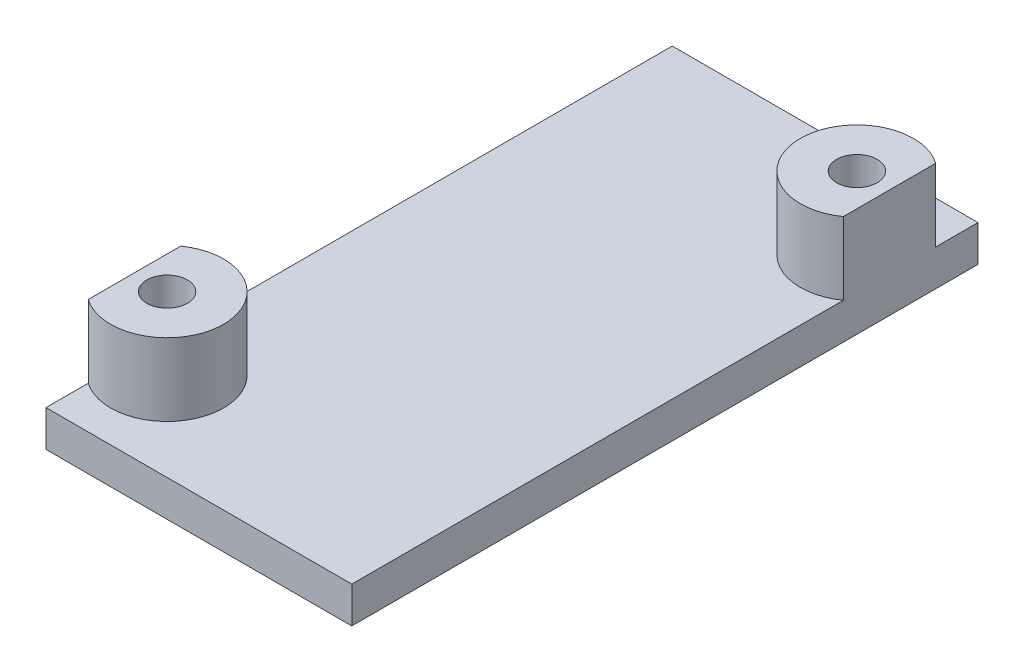
from build123d import *

# Parameters (mm, degrees)
SKETCH1_W           = 21.082
SKETCH1_H           = 43.18
BOSS_EXTRUDE1_DEPTH = 2.5
SKETCH2_R           = 1.4
BOSS_EXTRUDE2_DEPTH = 5


with BuildPart() as part:
    # Sketch1 → Boss-Extrude1 (new body)
    with BuildSketch(Plane(origin=(0, 0, 0), x_dir=(1, 0, 0), z_dir=(0, 1, 0))):
        Rectangle(SKETCH1_W, SKETCH1_H)
    extrude(amount=BOSS_EXTRUDE1_DEPTH)

    # Sketch2 → Boss-Extrude2 (add)
    # profile 1 of 2: a face of its own
    with BuildSketch(Plane(origin=(0, 2.5, 0), x_dir=(1, 0, 0), z_dir=(0, 1, 0))):
        with BuildLine():
            Line((10.541, 12.304485913), (10.541, 18.675514087))
            ThreePointArc((10.541, 18.675514087), (4.391, 15.49), (10.541, 12.304485913))
        make_face()
        with Locations(Location((8.291, 15.49, 0), (0, 0, 270))):
            Circle(SKETCH2_R, mode=Mode.SUBTRACT)
    # profile 2 of 2: a face of its own
    with BuildSketch(Plane(origin=(0, 2.5, 0), x_dir=(1, 0, 0), z_dir=(0, 1, 0))):
        with BuildLine():
            ThreePointArc((-10.541, -18.675514087), (-4.391, -15.49), (-10.541, -12.304485913))
            Line((-10.541, -12.304485913), (-10.541, -18.675514087))
        make_face()
        with Locations(Location((-8.291, -15.49, 0), (0, 0, 270))):
            Circle(SKETCH2_R, mode=Mode.SUBTRACT)
    extrude(amount=BOSS_EXTRUDE2_DEPTH)


solid = part.part
